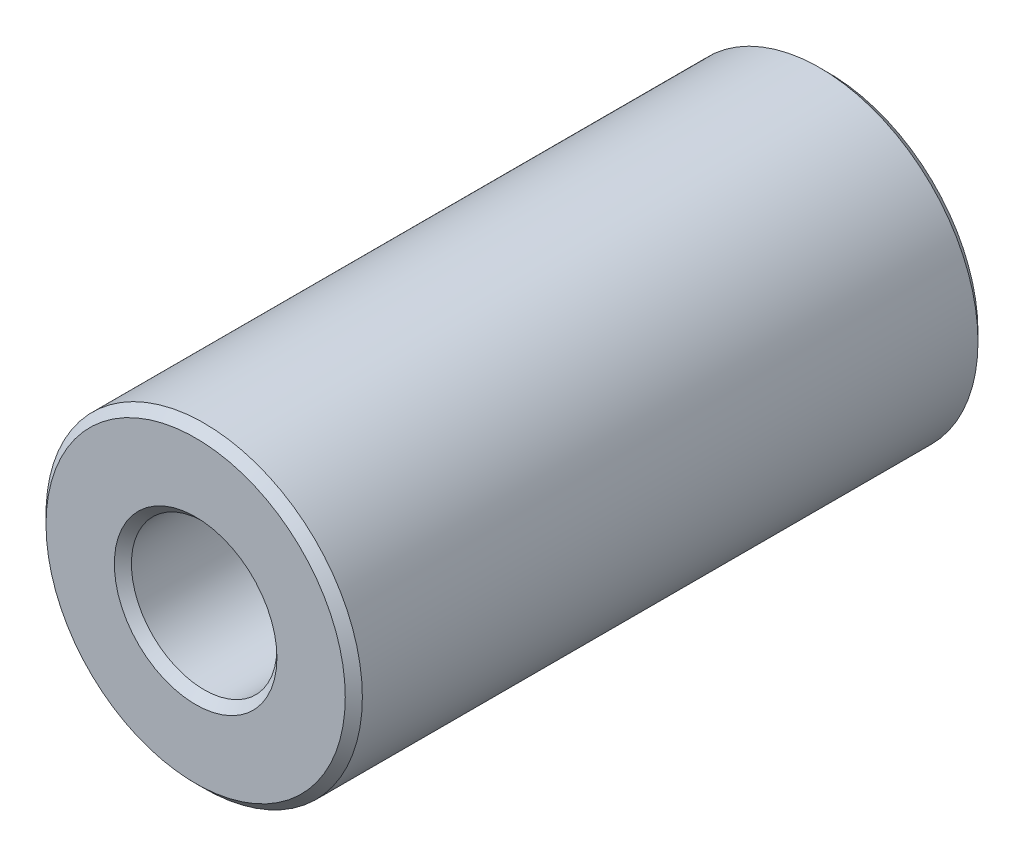
from build123d import *

# Parameters (mm, degrees)
BOSS_EXTRUDE1_DEPTH      = 6.35
BOSS_EXTRUDE1_DEPTH_BACK = 6.35
SKETCH3_R                = 3.175
SKETCH3_R_2              = 1.4605
CHAMFER1_SIZE            = 0.17145


with BuildPart() as part:
    # Sketch3 → Boss-Extrude1 (new, two sides: drawn at the far end of the back side and taken through both)
    with BuildSketch(Plane.XY.offset(-BOSS_EXTRUDE1_DEPTH_BACK)):
        Circle(SKETCH3_R)
        Circle(SKETCH3_R_2, mode=Mode.SUBTRACT)
    extrude(amount=BOSS_EXTRUDE1_DEPTH + BOSS_EXTRUDE1_DEPTH_BACK)

    # Chamfer1
    chamfer1_edges = [part.edges().sort_by_distance(p)[0] for p in [
        (-3.175, 0, -6.35),
        (-1.4605, 0, -6.35),
        (-3.175, 0, 6.35),
        (-1.4605, 0, 6.35),
    ]]
    chamfer(chamfer1_edges, length=CHAMFER1_SIZE)


solid = part.part
